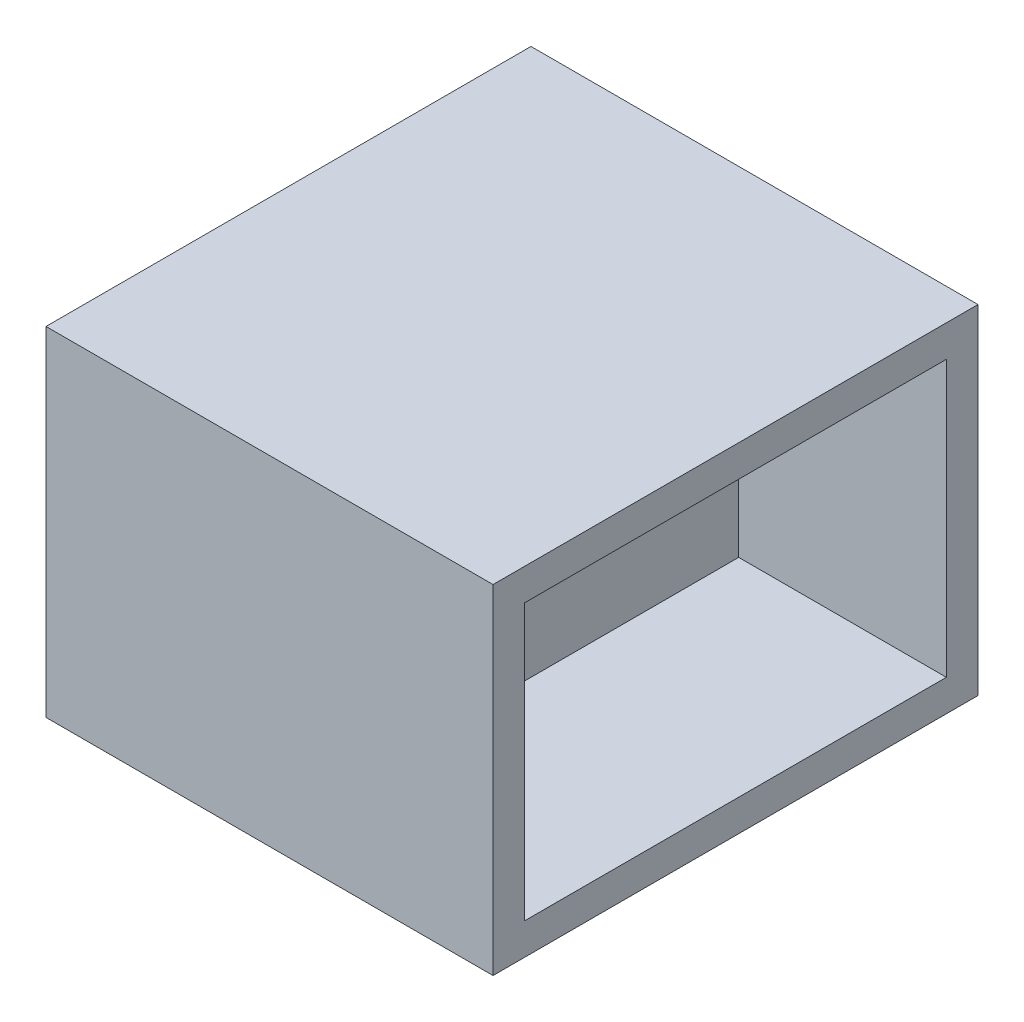
from build123d import *

# Parameters (mm, degrees)
SKETCH1_W           = 42.4
SKETCH1_H           = 32.12
BOSS_EXTRUDE1_DEPTH = 3
BOSS_EXTRUDE2_DEPTH = 40
SKETCH3_W           = 42.4
SKETCH3_H           = 32.12
BOSS_EXTRUDE3_DEPTH = 3


with BuildPart() as part:
    # Sketch1 → Boss-Extrude1 (new body)
    with BuildSketch(Plane.XY):
        Rectangle(SKETCH1_W, SKETCH1_H)
    extrude(amount=BOSS_EXTRUDE1_DEPTH)

    # Sketch2 → Boss-Extrude2 (add)
    with BuildSketch(Plane.XY.offset(3)):
        Polygon((-21.2, 16.06), (-21.2, 13.06), (-1.5, 13.06), (-1.5, -13.06), (-21.2, -13.06), (-21.2, -16.06), (21.2, -16.06), (21.2, -13.06), (1.5, -13.06), (1.5, 13.06), (21.2, 13.06), (21.2, 16.06), align=None)
    extrude(amount=BOSS_EXTRUDE2_DEPTH)

    # Sketch3 → Boss-Extrude3 (add)
    with BuildSketch(Plane.XY.offset(43)):
        Rectangle(SKETCH3_W, SKETCH3_H)
    extrude(amount=BOSS_EXTRUDE3_DEPTH)


solid = part.part
